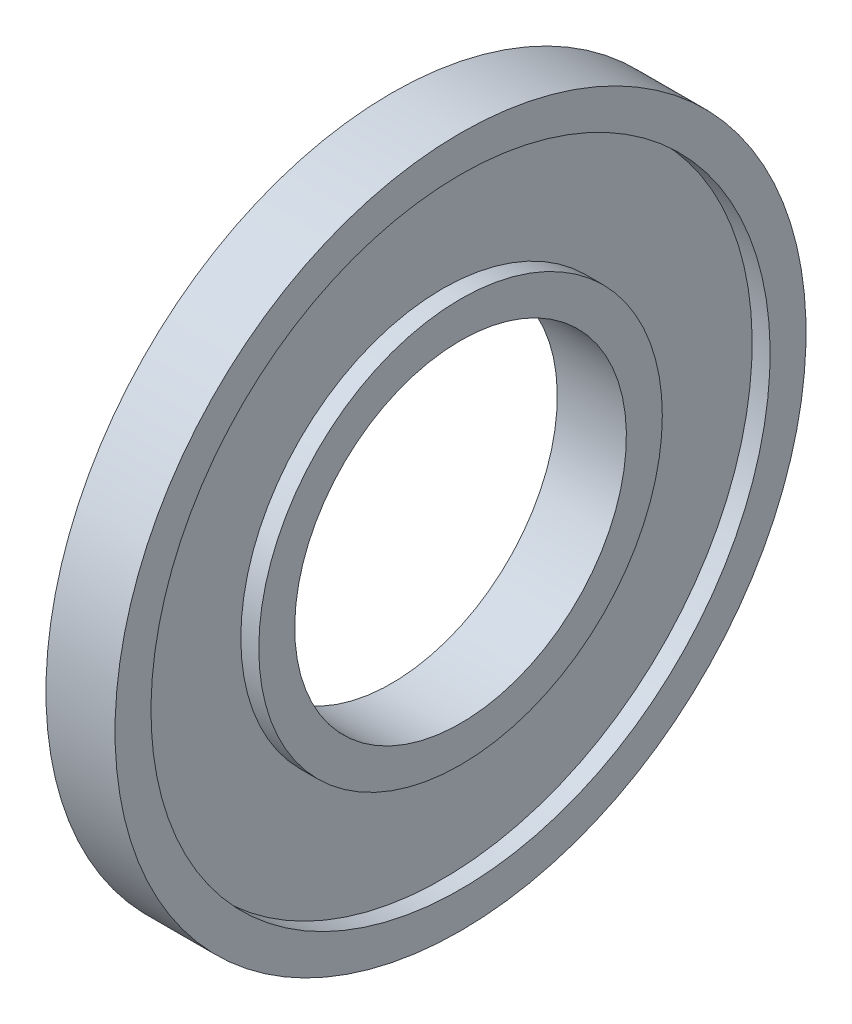
from build123d import *


with BuildPart() as part:
    # Sketch1 → Revolve1 (revolve)
    with BuildSketch(Plane.XY):
        Polygon((-2.5, 25), (2.5, 25), (2.5, 22.4), (1.2, 22.4), (1.2, 14.6), (2.5, 14.6), (2.5, 12), (-2.5, 12), (-2.5, 14.6), (-1.2, 14.6), (-1.2, 22.4), (-2.5, 22.4), align=None)
    revolve(axis=Axis((6.481208189, 0, 0), (-1, 0, 0)))


solid = part.part
